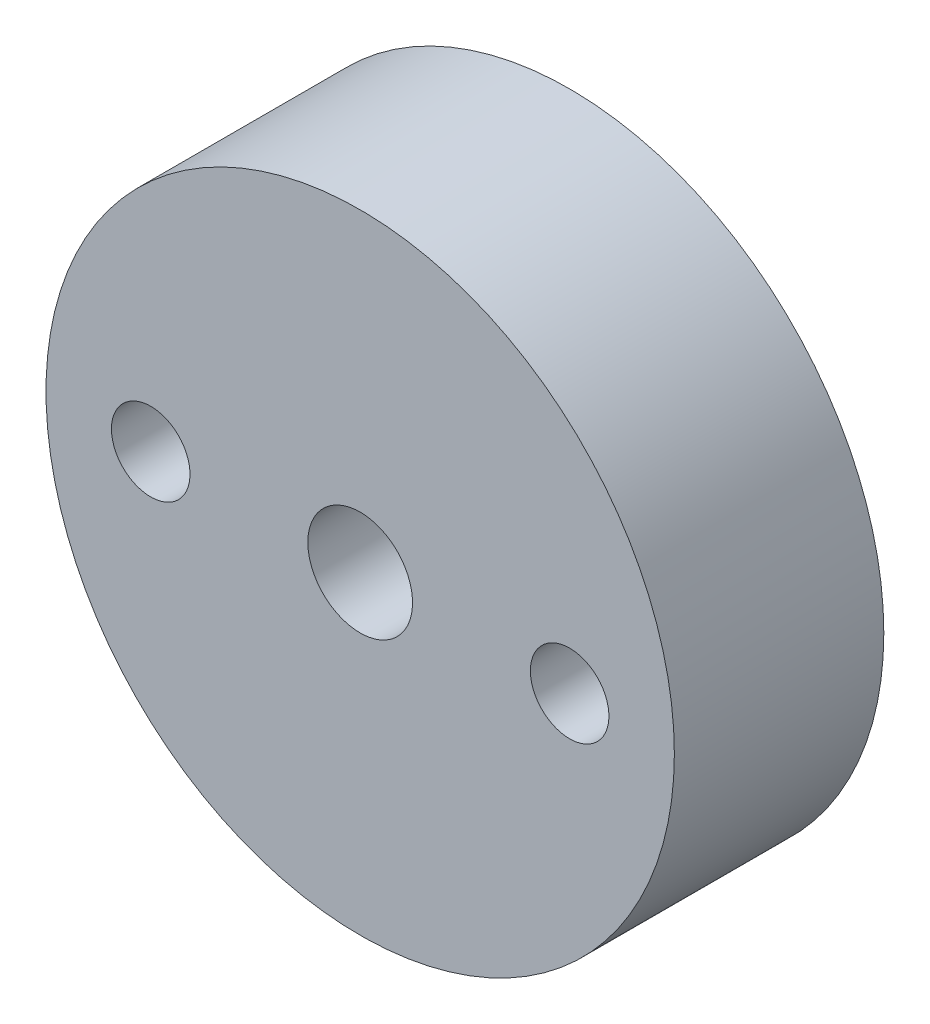
from build123d import *

# Parameters (mm, degrees)
SKETCH1_R                   = 38.1
OD_DON_T_CARE_DEPTH         = 25.4
SKETCH2_R                   = 4.7625
F_3_8_16_TAPPED_HOLES_DEPTH = 60.56828015
SKETCH4_R                   = 6.35
F_1_2_13_TAPPED_HOLE_DEPTH  = 60.56828015


with BuildPart() as part:
    # Sketch1 → OD Don't Care (new body)
    with BuildSketch(Plane.XY):
        Circle(SKETCH1_R)
    extrude(amount=OD_DON_T_CARE_DEPTH)

    # Sketch2 → 3/8"-16 Tapped Holes (cut, through all)
    with BuildSketch(Plane(origin=(0, 0, 0), x_dir=(-1, 0, 0), z_dir=(0, 0, -1))):
        with Locations((-25.4, 0)):
            Circle(SKETCH2_R)
        with Locations((25.4, 0)):
            Circle(SKETCH2_R)
    extrude(amount=-F_3_8_16_TAPPED_HOLES_DEPTH, mode=Mode.SUBTRACT)

    # Sketch4 → 1/2"-13 Tapped Hole (cut, through all)
    with BuildSketch(Plane(origin=(0, 0, 0), x_dir=(-1, 0, 0), z_dir=(0, 0, -1))):
        Circle(SKETCH4_R)
    extrude(amount=-F_1_2_13_TAPPED_HOLE_DEPTH, mode=Mode.SUBTRACT)


solid = part.part
